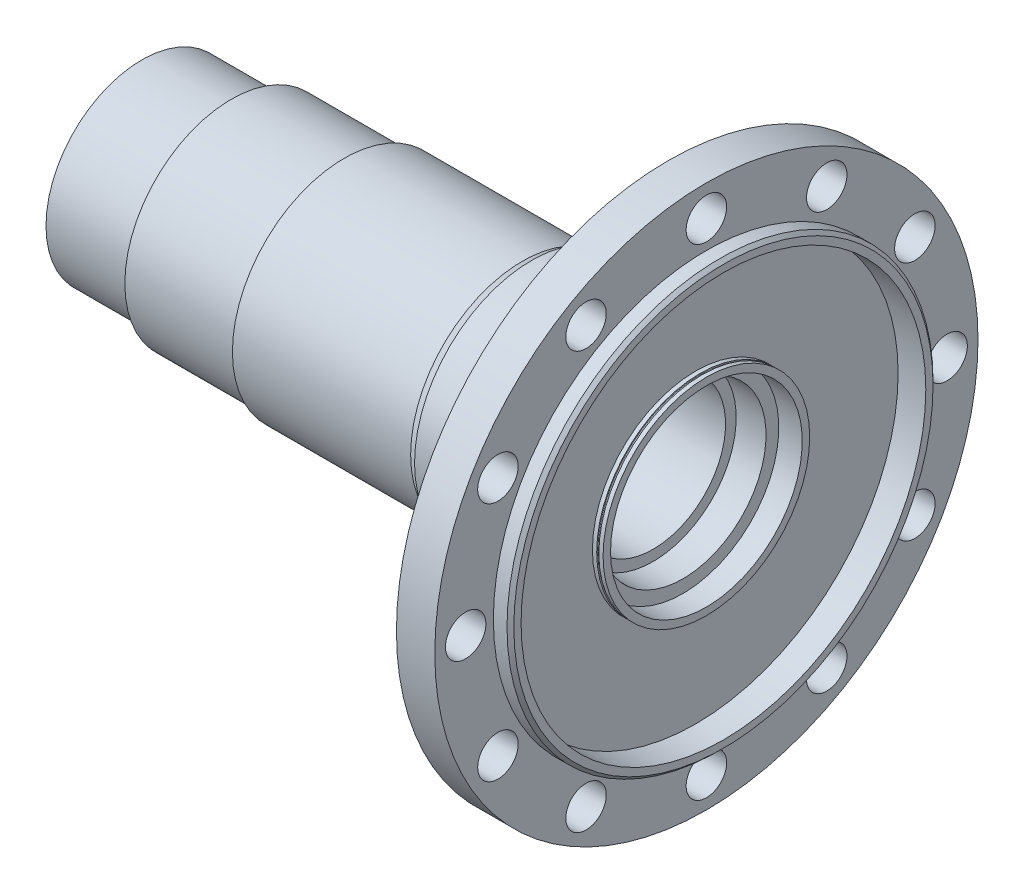
from build123d import *

# Parameters (mm, degrees)
SKETCH_3_W           = 2
SKETCH_3_H           = 46.5
SKETCH_5_W           = 2
SKETCH_5_H           = 46.5
SKETCH_6_R           = 9.5
CUT_EXTRUDE_1_DEPTH  = 328.171973127
SKETCH_7_R           = 9.5
CUT_EXTRUDE_2_DEPTH  = 328.171973127
SKETCH_8_R           = 9.5
CUT_EXTRUDE_3_DEPTH  = 328.171973127
SKETCH_9_R           = 9.5
CUT_EXTRUDE_4_DEPTH  = 328.171973127
SKETCH_10_R          = 9.5
CUT_EXTRUDE_5_DEPTH  = 328.171973127
SKETCH_11_R          = 9.5
CUT_EXTRUDE_6_DEPTH  = 328.171973127
SKETCH_12_R          = 9.5
CUT_EXTRUDE_7_DEPTH  = 328.171973127
SKETCH_13_R          = 9.5
CUT_EXTRUDE_8_DEPTH  = 328.171973127
SKETCH_14_R          = 9.5
CUT_EXTRUDE_9_DEPTH  = 328.171973127
SKETCH_15_R          = 9.5
CUT_EXTRUDE_10_DEPTH = 328.171973127
SKETCH_16_R          = 9.5
CUT_EXTRUDE_11_DEPTH = 328.171973127
SKETCH_17_R          = 9.5
CUT_EXTRUDE_12_DEPTH = 328.171973127


with BuildPart() as part:
    # Эскиз1 → Повернуть1 (revolve)
    with BuildSketch(Plane.XY, mode=Mode.PRIVATE) as revolve_1_sk:
        Polygon((0, 0), (273, 0), (273, 98.4), (271.4, 100), (265, 100), (265, 127.5), (247, 127.5), (247, 100), (239, 100), (239, 62.5), (215, 62.5), (215, 55), (183, 55), (178.669872981, 52.5), (95, 52.5), (95, 50), (42, 50), (42, 45), (0, 45), align=None)
    revolve(revolve_1_sk.sketch.rotate(Axis((0, 0, 0), (1, 0, 0)), 90), axis=Axis((0, 0, 0), (1, 0, 0)))

    # Эскиз2 → Вырез-Повернуть1 (revolve, cut)
    with BuildSketch(Plane.XY, mode=Mode.PRIVATE) as cut_revolve_1_sk:
        Polygon((0, 0), (273, 0), (273, 95), (265, 95), (265, 45), (254, 45), (254, 39), (240, 39), (240, 34), (203.5, 34), (203.5, 31), (0, 31), align=None)
    revolve(cut_revolve_1_sk.sketch.rotate(Axis((0, 0, 0), (1, 0, 0)), 90), axis=Axis((0, 0, 0), (1, 0, 0)), mode=Mode.SUBTRACT)

    # Эскиз3 → Rear_recess_left (revolve, cut)
    with BuildSketch(Plane.XY, mode=Mode.PRIVATE) as rear_recess_left_sk:
        with Locations((261, 71.75)):
            Rectangle(SKETCH_3_W, SKETCH_3_H)
    revolve(rear_recess_left_sk.sketch.rotate(Axis((0, 0, 0), (1, 0, 0)), 90), axis=Axis((0, 0, 0), (1, 0, 0)), mode=Mode.SUBTRACT)

    # Эскиз4 → Collar_groove_nominal (revolve, cut)
    with BuildSketch(Plane.XY, mode=Mode.PRIVATE) as collar_groove_nominal_sk:
        with BuildLine():
            Line((263, 48), (263, 95))
            Line((263, 95), (262, 95))
            Line((262, 95), (262, 48))
            ThreePointArc((262, 48), (262.146446609, 47.646446609), (262.5, 47.5))
            ThreePointArc((262.5, 47.5), (262.853553391, 47.646446609), (263, 48))
        make_face()
    revolve(collar_groove_nominal_sk.sketch.rotate(Axis((0, 0, 0), (1, 0, 0)), 90), axis=Axis((0, 0, 0), (1, 0, 0)), mode=Mode.SUBTRACT)

    # Эскиз5 → Rear_recess_lip (revolve, cut)
    with BuildSketch(Plane.XY, mode=Mode.PRIVATE) as rear_recess_lip_sk:
        with Locations((264, 71.75)):
            Rectangle(SKETCH_5_W, SKETCH_5_H)
    revolve(rear_recess_lip_sk.sketch.rotate(Axis((0, 0, 0), (1, 0, 0)), 90), axis=Axis((0, 0, 0), (1, 0, 0)), mode=Mode.SUBTRACT)

    # Эскиз6 → Вырез-Вытянуть1 (cut, through all)
    with BuildSketch(Plane(origin=(0, 0, 0), x_dir=(0, 0, -1), z_dir=(1, 0, 0))):
        with Locations(Location((0, 113, 0), (0, 0, 180))):
            Circle(SKETCH_6_R)
    extrude(amount=CUT_EXTRUDE_1_DEPTH, mode=Mode.SUBTRACT)

    # Эскиз7 → Вырез-Вытянуть2 (cut, through all)
    with BuildSketch(Plane(origin=(0, 0, 0), x_dir=(0, 0, -1), z_dir=(1, 0, 0))):
        with Locations(Location((-56.5, 97.860870628, 0), (0, 0, 180))):
            Circle(SKETCH_7_R)
    extrude(amount=CUT_EXTRUDE_2_DEPTH, mode=Mode.SUBTRACT)

    # Эскиз8 → Вырез-Вытянуть3 (cut, through all)
    with BuildSketch(Plane(origin=(0, 0, 0), x_dir=(0, 0, -1), z_dir=(1, 0, 0))):
        with Locations(Location((-97.860870628, 56.5, 0), (0, 0, 180))):
            Circle(SKETCH_8_R)
    extrude(amount=CUT_EXTRUDE_3_DEPTH, mode=Mode.SUBTRACT)

    # Эскиз9 → Вырез-Вытянуть4 (cut, through all)
    with BuildSketch(Plane(origin=(0, 0, 0), x_dir=(0, 0, -1), z_dir=(1, 0, 0))):
        with Locations(Location((-113, 0, 0), (0, 0, 180))):
            Circle(SKETCH_9_R)
    extrude(amount=CUT_EXTRUDE_4_DEPTH, mode=Mode.SUBTRACT)

    # Эскиз10 → Вырез-Вытянуть5 (cut, through all)
    with BuildSketch(Plane(origin=(0, 0, 0), x_dir=(0, 0, -1), z_dir=(1, 0, 0))):
        with Locations(Location((-97.860870628, -56.5, 0), (0, 0, 180))):
            Circle(SKETCH_10_R)
    extrude(amount=CUT_EXTRUDE_5_DEPTH, mode=Mode.SUBTRACT)

    # Эскиз11 → Вырез-Вытянуть6 (cut, through all)
    with BuildSketch(Plane(origin=(0, 0, 0), x_dir=(0, 0, -1), z_dir=(1, 0, 0))):
        with Locations(Location((-56.5, -97.860870628, 0), (0, 0, 180))):
            Circle(SKETCH_11_R)
    extrude(amount=CUT_EXTRUDE_6_DEPTH, mode=Mode.SUBTRACT)

    # Эскиз12 → Вырез-Вытянуть7 (cut, through all)
    with BuildSketch(Plane(origin=(0, 0, 0), x_dir=(0, 0, -1), z_dir=(1, 0, 0))):
        with Locations(Location((0, -113, 0), (0, 0, 180))):
            Circle(SKETCH_12_R)
    extrude(amount=CUT_EXTRUDE_7_DEPTH, mode=Mode.SUBTRACT)

    # Эскиз13 → Вырез-Вытянуть8 (cut, through all)
    with BuildSketch(Plane(origin=(0, 0, 0), x_dir=(0, 0, -1), z_dir=(1, 0, 0))):
        with Locations(Location((56.5, -97.860870628, 0), (0, 0, 180))):
            Circle(SKETCH_13_R)
    extrude(amount=CUT_EXTRUDE_8_DEPTH, mode=Mode.SUBTRACT)

    # Эскиз14 → Вырез-Вытянуть9 (cut, through all)
    with BuildSketch(Plane(origin=(0, 0, 0), x_dir=(0, 0, -1), z_dir=(1, 0, 0))):
        with Locations(Location((97.860870628, -56.5, 0), (0, 0, 180))):
            Circle(SKETCH_14_R)
    extrude(amount=CUT_EXTRUDE_9_DEPTH, mode=Mode.SUBTRACT)

    # Эскиз15 → Вырез-Вытянуть10 (cut, through all)
    with BuildSketch(Plane(origin=(0, 0, 0), x_dir=(0, 0, -1), z_dir=(1, 0, 0))):
        with Locations(Location((113, 0, 0), (0, 0, 180))):
            Circle(SKETCH_15_R)
    extrude(amount=CUT_EXTRUDE_10_DEPTH, mode=Mode.SUBTRACT)

    # Эскиз16 → Вырез-Вытянуть11 (cut, through all)
    with BuildSketch(Plane(origin=(0, 0, 0), x_dir=(0, 0, -1), z_dir=(1, 0, 0))):
        with Locations(Location((97.860870628, 56.5, 0), (0, 0, 180))):
            Circle(SKETCH_16_R)
    extrude(amount=CUT_EXTRUDE_11_DEPTH, mode=Mode.SUBTRACT)

    # Эскиз17 → Вырез-Вытянуть12 (cut, through all)
    with BuildSketch(Plane(origin=(0, 0, 0), x_dir=(0, 0, -1), z_dir=(1, 0, 0))):
        with Locations(Location((56.5, 97.860870628, 0), (0, 0, 180))):
            Circle(SKETCH_17_R)
    extrude(amount=CUT_EXTRUDE_12_DEPTH, mode=Mode.SUBTRACT)


solid = part.part
